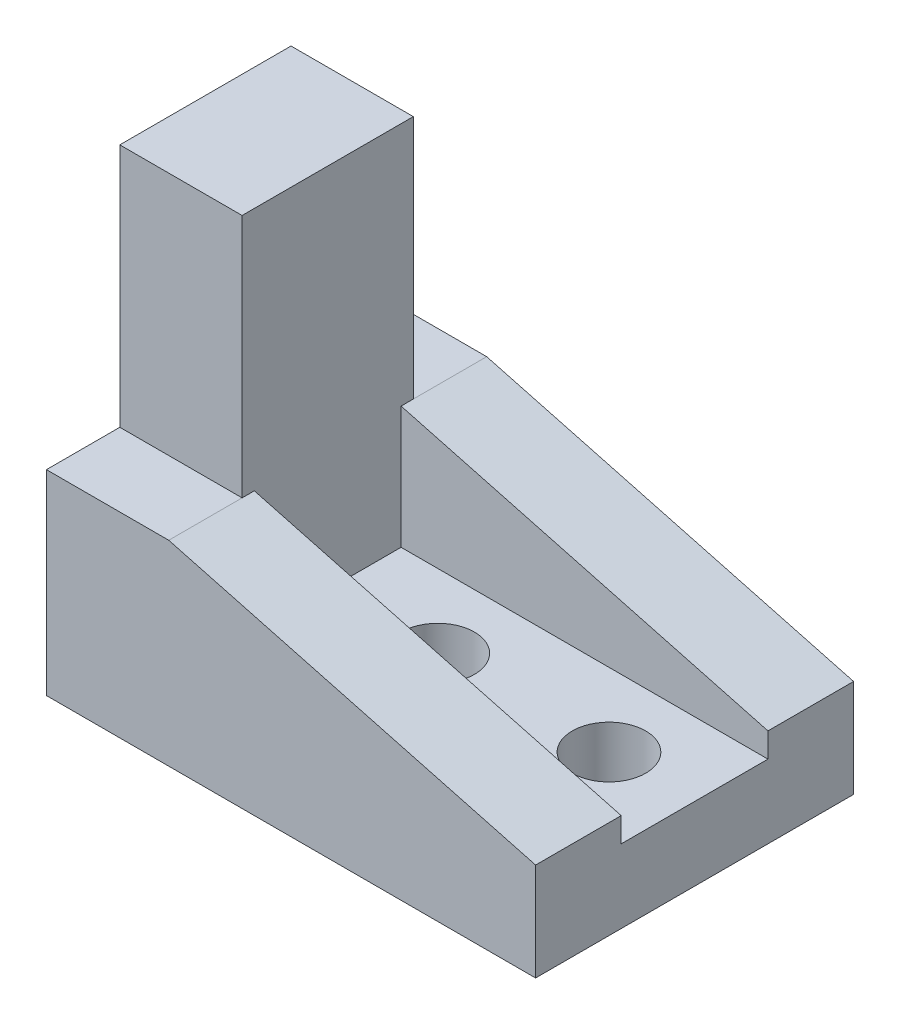
from build123d import *

# Parameters (mm, degrees)
EXTRUDE_1_DEPTH     = 13
SKETCH_2_W          = 3
SKETCH_2_H          = 10
CUT_EXTRUDE_1_DEPTH = 30.883105595
CUT_EXTRUDE_2_DEPTH = 5
SKETCH_4_R          = 1.5
CUT_EXTRUDE_3_DEPTH = 29.178005607


with BuildPart() as part:
    # 草图1 → 凸台-拉伸1 (new body)
    with BuildSketch(Plane.XY):
        Polygon((0, 0), (20, 0), (20, 4), (5, 8), (5, 18), (0, 18), align=None)
    extrude(amount=EXTRUDE_1_DEPTH)

    # 草图2 → 切除-拉伸1 (cut, through all)
    with BuildSketch(Plane.ZY):
        with Locations((1.5, 13)):
            Rectangle(SKETCH_2_W, SKETCH_2_H)
        with Locations((11.5, 13)):
            Rectangle(SKETCH_2_W, SKETCH_2_H)
    extrude(amount=-CUT_EXTRUDE_1_DEPTH, mode=Mode.SUBTRACT)

    # 草图3 → 切除-拉伸2 (cut)
    with BuildSketch(Plane(origin=(0, 8, 0), x_dir=(-1, 0, 0), z_dir=(0, -1, 0))):
        Polygon((-5, -6.5), (-5, -9.5), (-20, -9.5), (-20, -3.5), (-5, -3.5), align=None)
    extrude(amount=CUT_EXTRUDE_2_DEPTH, mode=Mode.SUBTRACT)

    # 草图4 → 切除-拉伸3 (cut, through all)
    with BuildSketch(Plane(origin=(0, 3, 0), x_dir=(1, 0, 0), z_dir=(0, 1, 0))):
        with Locations(Location((16.5, -6.5, 0), (0, 0, 270))):
            Circle(SKETCH_4_R)
        with Locations(Location((9.5, -6.5, 0), (0, 0, 270))):
            Circle(SKETCH_4_R)
    extrude(amount=-CUT_EXTRUDE_3_DEPTH, mode=Mode.SUBTRACT)


solid = part.part
